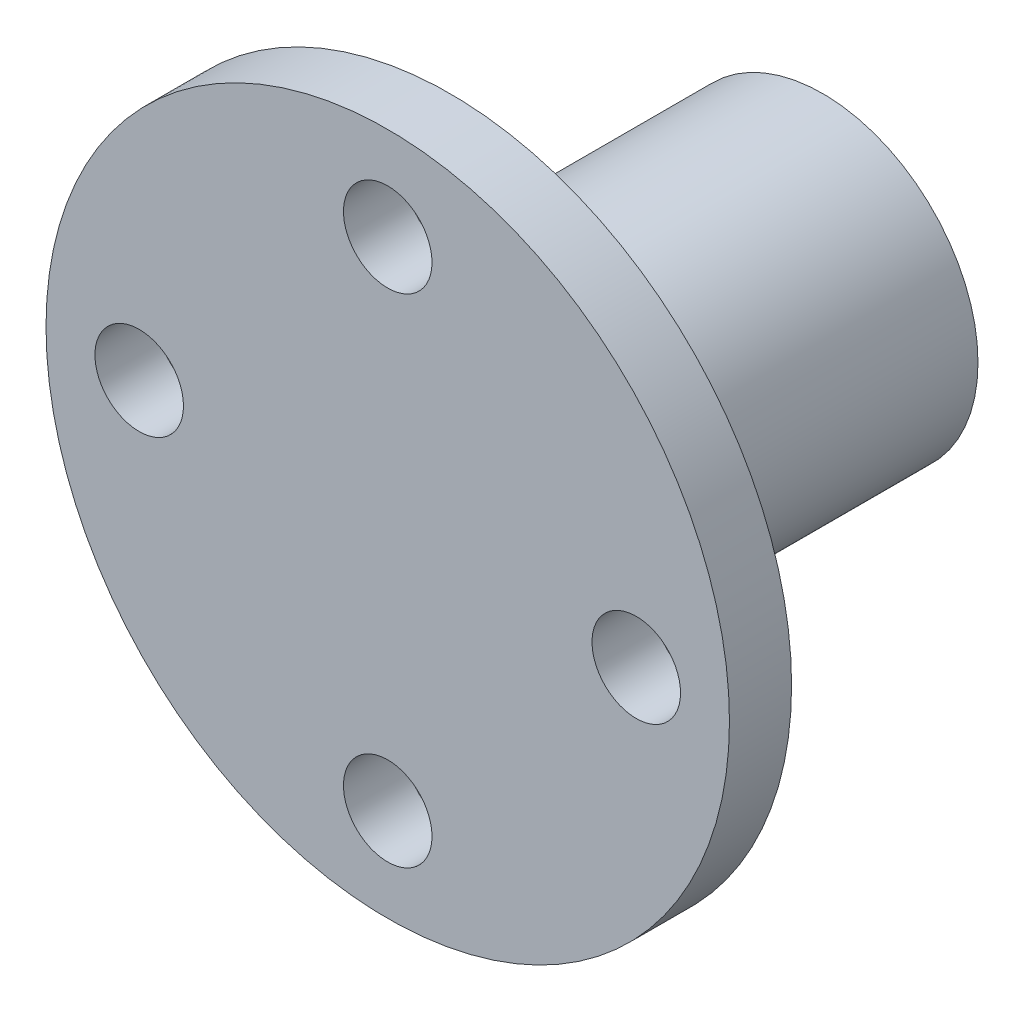
from build123d import *

# Parameters (mm, degrees)
SKETCH1_R           = 11
SKETCH1_R_2         = 1.425
BOSS_EXTRUDE1_DEPTH = 2
SKETCH1_4_R         = 5
SKETCH1_4_R_2       = 3
BOSS_EXTRUDE2_DEPTH = 12


with BuildPart() as part:
    # Sketch1 → Boss-Extrude1 (new body)
    with BuildSketch(Plane.XY):
        Circle(SKETCH1_R)
        with Locations((0, -8)):
            Circle(SKETCH1_R_2, mode=Mode.SUBTRACT)
        with Locations((8, 0)):
            Circle(SKETCH1_R_2, mode=Mode.SUBTRACT)
        with Locations((-8, 0)):
            Circle(SKETCH1_R_2, mode=Mode.SUBTRACT)
        with Locations((0, 8)):
            Circle(SKETCH1_R_2, mode=Mode.SUBTRACT)
    extrude(amount=BOSS_EXTRUDE1_DEPTH)

    # Sketch1<4> → Boss-Extrude2 (add)
    with BuildSketch(Plane.XY):
        Circle(SKETCH1_4_R)
        Circle(SKETCH1_4_R_2, mode=Mode.SUBTRACT)
    extrude(amount=-BOSS_EXTRUDE2_DEPTH)


solid = part.part
